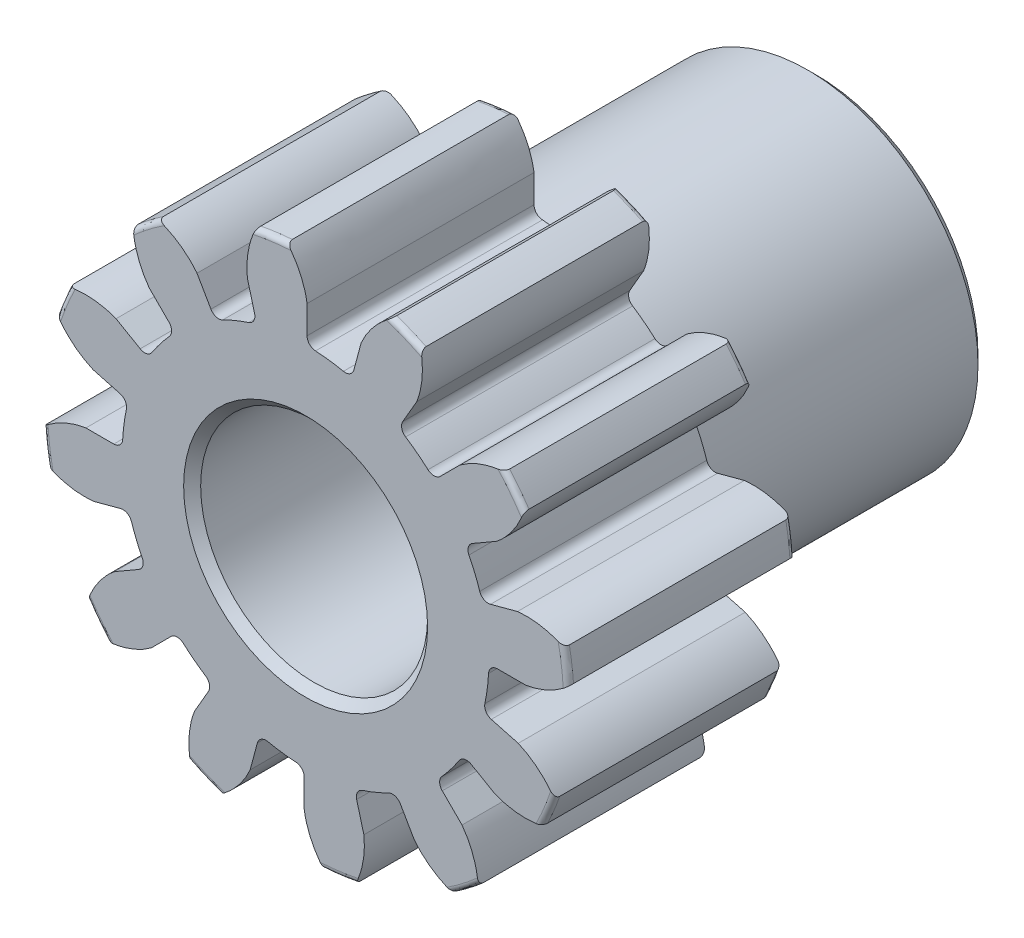
from build123d import *

# Parameters (mm, degrees)
SKETCH1_R                = 7.366
BOSS_EXTRUDE1_DEPTH      = 6.35
SKETCH2_W                = 7.9375
SKETCH2_H                = 4.7625
FILLET2_R                = 0.14732
CUT_EXTRUDE1_DEPTH       = 18.681871175
FILLET1_R                = 0.2493645
CIRPATTERN1_COUNT        = 12
FILLET1_OF_CIRPATTERN1_R = 0.2493645
SKETCH5_R                = 3.175
CUT_EXTRUDE2_DEPTH       = 18.666583801
CHAMFER1_SIZE            = 0.238125


with BuildPart() as part:
    # Sketch1 → Boss-Extrude1 (new body)
    with BuildSketch(Plane.XY):
        Circle(SKETCH1_R)
    extrude(amount=-BOSS_EXTRUDE1_DEPTH)

    # Sketch2 → Revolve1 (revolve)
    with BuildSketch(Plane(origin=(0, 0, 0), x_dir=(0, 0, -1), z_dir=(1, 0, 0)), mode=Mode.PRIVATE) as revolve1_sk:
        with Locations((10.31875, 2.38125)):
            Rectangle(SKETCH2_W, SKETCH2_H)
    revolve(revolve1_sk.sketch.rotate(Axis((0, 0, -6.35), (0, 0, -1)), 90), axis=Axis((0, 0, -6.35), (0, 0, -1)))

    # Fillet2
    fillet2_edges = [part.edges().sort_by_distance(p)[0] for p in [
        (-7.366, 0, 0),
        (-7.366, 0, -6.35),
        (-4.7625, 0, -6.35),
    ]]
    fillet(fillet2_edges, radius=FILLET2_R)

    # Sketch4 → Cut-Extrude1 (cut, through all)
    with BuildSketch(Plane.XY):
        with BuildLine():
            Line((0.039954341, 6.147607683), (0.039954341, 5.125352605))
            ThreePointArc((0.039954341, 5.125352605), (0.669014641, 5.081658694), (1.287948975, 4.961050606))
            Line((1.287948975, 4.961050606), (1.552528662, 5.948473025))
            add(Edge.make_bspline(
                [(2.447477101, 6.992325707), (1.830193727, 6.582214897), (1.552528662, 5.948473025)],
                knots=[0, 0, 0, 1, 1, 1], degree=2))
            ThreePointArc((2.447477101, 6.992325707), (0.966978152, 7.344910905), (-0.554329756, 7.387522012))
            add(Edge.make_bspline(
                [(-0.554329756, 7.387522012), (-0.064224631, 6.831620395), (0.039954341, 6.147607683)],
                knots=[0, 0, 0, 1, 1, 1], degree=2))
        make_face()
    cut_extrude1 = extrude(amount=-CUT_EXTRUDE1_DEPTH, mode=Mode.SUBTRACT)

    # Fillet1
    fillet1_edges = [part.edges().sort_by_distance(p)[0] for p in [
        (1.287948975, 4.961050606, -3.175),
        (0.039954341, 5.125352605, -3.175),
    ]]
    fillet(fillet1_edges, radius=FILLET1_R)

    # CirPattern1: Cut-Extrude1 ×12 about axis
    cirpattern1_axis = Axis((0, 0, -6.35), (0, 0, 1))
    for i in range(1, CIRPATTERN1_COUNT):
        add(cut_extrude1.rotate(cirpattern1_axis, i * 360 / CIRPATTERN1_COUNT), mode=Mode.SUBTRACT)

    # Fillet1 of CirPattern1
    fillet1_of_cirpattern1_edges = [part.edges().sort_by_distance(p)[0] for p in [
        (-1.365128772, 4.940370341, -3.175),
        (-2.528074828, 4.45866273, -3.175),
        (-3.652421367, 3.595921834, -3.175),
        (-4.418708389, 2.597277777, -3.175),
        (-4.961050606, 1.287948975, -3.175),
        (-5.125352605, 0.039954341, -3.175),
        (-4.940370341, -1.365128772, -3.175),
        (-4.45866273, -2.528074828, -3.175),
        (-3.595921834, -3.652421367, -3.175),
        (-2.597277777, -4.418708389, -3.175),
        (-1.287948975, -4.961050606, -3.175),
        (-0.039954341, -5.125352605, -3.175),
        (1.365128772, -4.940370341, -3.175),
        (2.528074828, -4.45866273, -3.175),
        (3.652421367, -3.595921834, -3.175),
        (4.418708389, -2.597277777, -3.175),
        (4.961050606, -1.287948975, -3.175),
        (5.125352605, -0.039954341, -3.175),
        (4.940370341, 1.365128772, -3.175),
        (4.45866273, 2.528074828, -3.175),
        (3.595921834, 3.652421367, -3.175),
        (2.597277777, 4.418708389, -3.175),
    ]]
    fillet(fillet1_of_cirpattern1_edges, radius=FILLET1_OF_CIRPATTERN1_R)

    # Sketch5 → Cut-Extrude2 (cut, through all)
    with BuildSketch(Plane.XY):
        Circle(SKETCH5_R)
    extrude(amount=-CUT_EXTRUDE2_DEPTH, mode=Mode.SUBTRACT)

    # Chamfer1
    chamfer1_edges = [part.edges().sort_by_distance(p)[0] for p in [
        (-4.7625, 0, -14.2875),
        (-3.175, 0, -14.2875),
        (-3.175, 0, 0),
    ]]
    chamfer(chamfer1_edges, length=CHAMFER1_SIZE)


solid = part.part
